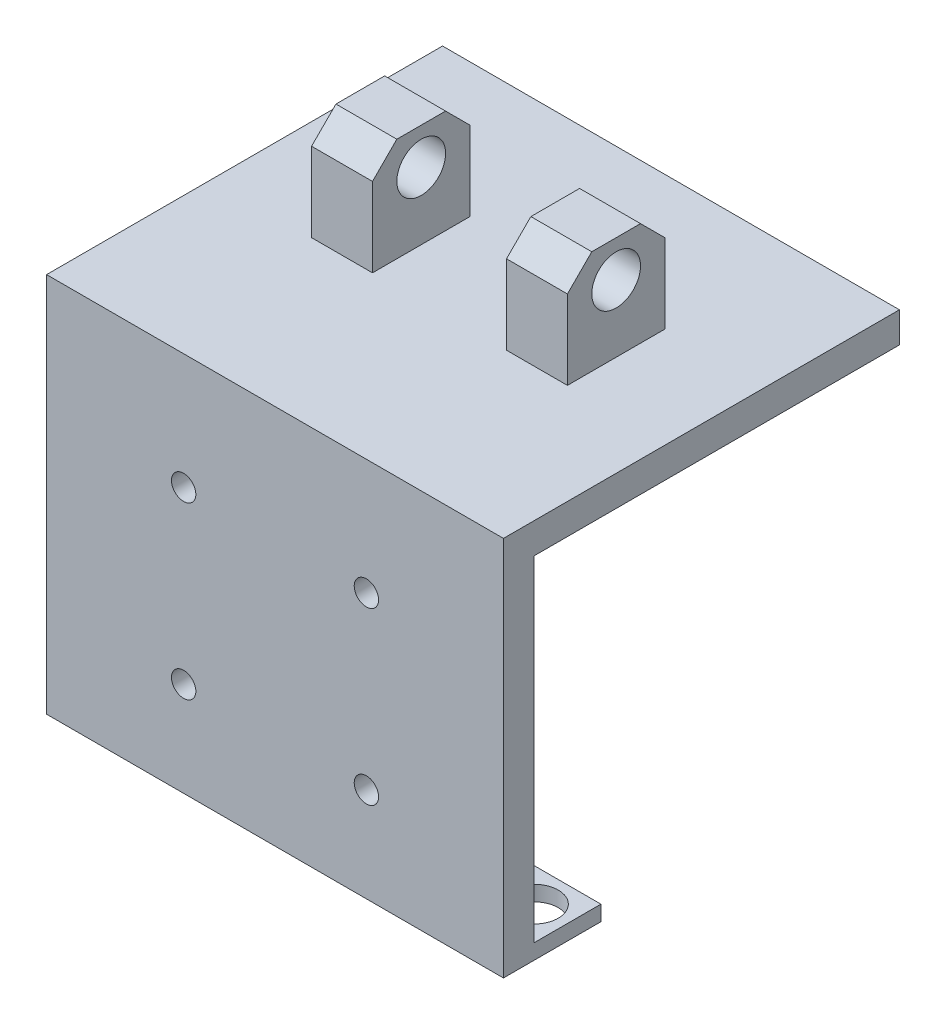
from build123d import *

# Parameters (mm, degrees)
SKETCH_1_W               = 75
SKETCH_1_H               = 16
SKETCH_1_R               = 4
EXTRUDE_1_DEPTH          = 2.5
SKETCH_3_W               = 75
SKETCH_3_H               = 5
EXTRUDE_2_DEPTH          = 60
CUT_EXTRUDE_1_REACH      = 89.199
SKETCH_4_R               = 2
SKETCH_5_W               = 75
SKETCH_5_H               = 5
EXTRUDE_3_DEPTH          = 60
SKETCH_6_W               = 10
SKETCH_6_H               = 16
EXTRUDE_4_DEPTH          = 22
CUT_EXTRUDE_2_DEPTH      = 113.985345572
CUT_EXTRUDE_2_DEPTH_BACK = 113.985345572
SKETCH_7_R               = 4
CHAMFER_1_SIZE           = 4


with BuildPart() as part:
    # 草图1 → 凸台-拉伸1 (new body)
    with BuildSketch(Plane(origin=(0, 0, 0), x_dir=(1, 0, 0), z_dir=(0, 1, 0))):
        with Locations((24.811158798, 1.43319531)):
            Rectangle(SKETCH_1_W, SKETCH_1_H)
        with Locations(Location((-7.188841202, 3.93319531, 0), (0, 0, 270))):
            Circle(SKETCH_1_R, mode=Mode.SUBTRACT)
        with Locations(Location((56.811158798, 3.93319531, 0), (0, 0, 270))):
            Circle(SKETCH_1_R, mode=Mode.SUBTRACT)
    extrude(amount=-EXTRUDE_1_DEPTH)

    # 草图3 → 凸台-拉伸2 (add)
    with BuildSketch(Plane(origin=(0, 0, 0), x_dir=(1, 0, 0), z_dir=(0, 1, 0))):
        with Locations((24.811158798, -4.06680469)):
            Rectangle(SKETCH_3_W, SKETCH_3_H)
    extrude(amount=EXTRUDE_2_DEPTH)

    # 草图4 → 切除-拉伸1 (cut, up to next)
    with BuildSketch(Plane(origin=(0, 0, 1.56680469), x_dir=(-1, 0, 0), z_dir=(0, 0, -1)), mode=Mode.PRIVATE) as cut_extrude_1_sk1:
        with Locations((-9.811158798, 13)):
            Circle(SKETCH_4_R)
    cut_extrude_1_tool1 = extrude(cut_extrude_1_sk1.sketch, amount=-CUT_EXTRUDE_1_REACH, mode=Mode.PRIVATE) & part.part
    # 草图4 → 切除-拉伸1 (cut, up to next)
    with BuildSketch(Plane(origin=(0, 0, 1.56680469), x_dir=(-1, 0, 0), z_dir=(0, 0, -1)), mode=Mode.PRIVATE) as cut_extrude_1_sk2:
        with Locations((-9.811158798, 41)):
            Circle(SKETCH_4_R)
    cut_extrude_1_tool2 = extrude(cut_extrude_1_sk2.sketch, amount=-CUT_EXTRUDE_1_REACH, mode=Mode.PRIVATE) & part.part
    # 草图4 → 切除-拉伸1 (cut, up to next)
    with BuildSketch(Plane(origin=(0, 0, 1.56680469), x_dir=(-1, 0, 0), z_dir=(0, 0, -1)), mode=Mode.PRIVATE) as cut_extrude_1_sk3:
        with Locations((-39.811158798, 41)):
            Circle(SKETCH_4_R)
    cut_extrude_1_tool3 = extrude(cut_extrude_1_sk3.sketch, amount=-CUT_EXTRUDE_1_REACH, mode=Mode.PRIVATE) & part.part
    # 草图4 → 切除-拉伸1 (cut, up to next)
    with BuildSketch(Plane(origin=(0, 0, 1.56680469), x_dir=(-1, 0, 0), z_dir=(0, 0, -1)), mode=Mode.PRIVATE) as cut_extrude_1_sk4:
        with Locations((-39.811158798, 13)):
            Circle(SKETCH_4_R)
    cut_extrude_1_tool4 = extrude(cut_extrude_1_sk4.sketch, amount=-CUT_EXTRUDE_1_REACH, mode=Mode.PRIVATE) & part.part
    add(cut_extrude_1_tool1.solids().sort_by_distance((9.811159, 13, 1.566805))[0], mode=Mode.SUBTRACT)
    add(cut_extrude_1_tool2.solids().sort_by_distance((9.811159, 41, 1.566805))[0], mode=Mode.SUBTRACT)
    add(cut_extrude_1_tool3.solids().sort_by_distance((39.811159, 41, 1.566805))[0], mode=Mode.SUBTRACT)
    add(cut_extrude_1_tool4.solids().sort_by_distance((39.811159, 13, 1.566805))[0], mode=Mode.SUBTRACT)

    # 草图5 → 凸台-拉伸3 (add)
    with BuildSketch(Plane(origin=(0, 0, 1.56680469), x_dir=(-1, 0, 0), z_dir=(0, 0, -1))):
        with Locations((-24.811158798, 57.5)):
            Rectangle(SKETCH_5_W, SKETCH_5_H)
    extrude(amount=EXTRUDE_3_DEPTH)

    # 草图6 → 凸台-拉伸4 (add)
    with BuildSketch(Plane.XZ.offset(-55)):
        with Locations((40.811158798, -28.43319531)):
            Rectangle(SKETCH_6_W, SKETCH_6_H)
        with Locations((8.811158798, -28.43319531)):
            Rectangle(SKETCH_6_W, SKETCH_6_H)
    extrude(amount=-EXTRUDE_4_DEPTH)

    # 草图7 → 切除-拉伸2 (cut, two sides: drawn at the far end of the back side and taken through both)
    with BuildSketch(Plane(origin=(45.811158798, 0, 0), x_dir=(0, 0, -1), z_dir=(1, 0, 0)).offset(-CUT_EXTRUDE_2_DEPTH_BACK)):
        with Locations((28.43319531, 71)):
            Circle(SKETCH_7_R)
    extrude(amount=CUT_EXTRUDE_2_DEPTH + CUT_EXTRUDE_2_DEPTH_BACK, mode=Mode.SUBTRACT)

    # 倒角1
    chamfer_1_edges = [part.edges().sort_by_distance(p)[0] for p in [
        (40.811158798, 77, -20.43319531),
        (40.811158798, 77, -36.43319531),
        (8.811158798, 77, -36.43319531),
        (8.811158798, 77, -20.43319531),
    ]]
    chamfer(chamfer_1_edges, length=CHAMFER_1_SIZE)


solid = part.part
